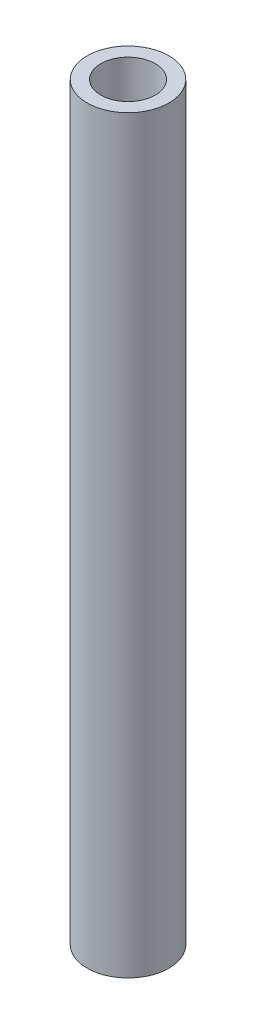
from build123d import *

# Parameters (mm, degrees)
CROQUIS1_W = 1
CROQUIS1_H = 55


with BuildPart() as part:
    # Croquis1 → Revolución1 (revolve)
    with BuildSketch(Plane.XY, mode=Mode.PRIVATE) as revoluci_n1_sk:
        with Locations((-2.5, 0)):
            Rectangle(CROQUIS1_W, CROQUIS1_H)
    revolve(revoluci_n1_sk.sketch.rotate(Axis((0, -0.720216084, 0), (0, 1, 0)), 180), axis=Axis((0, -0.720216084, 0), (0, 1, 0)))


solid = part.part
